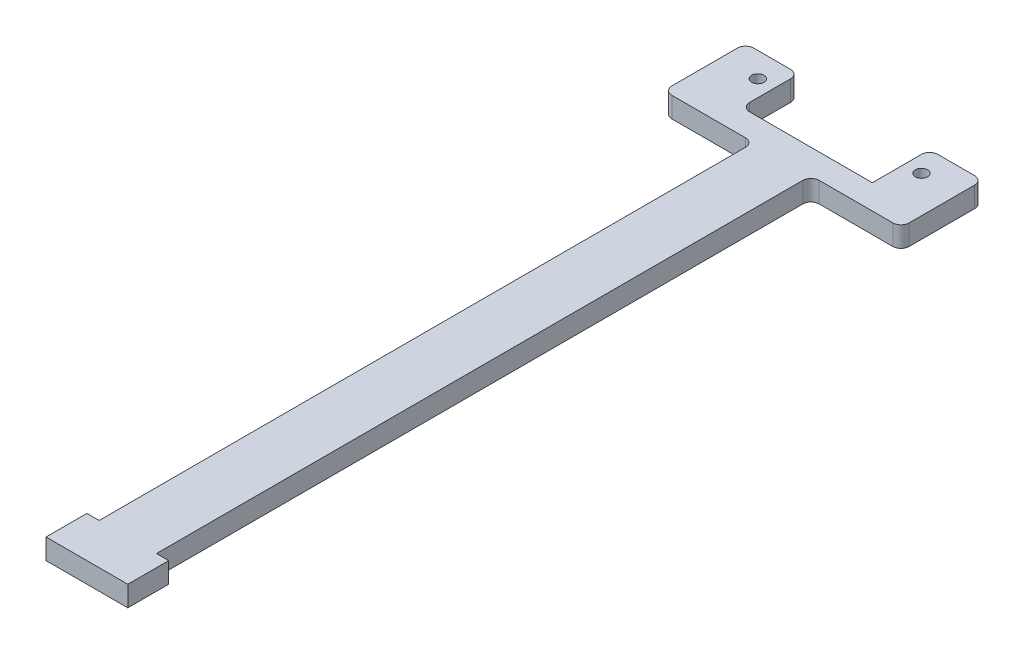
from build123d import *

# Parameters (mm, degrees)
BOSS_EXTRUDE1_DEPTH = 5
SKETCH2_R           = 1.5
SKETCH2_W           = 32
SKETCH2_H           = 14
CUT_EXTRUDE1_DEPTH  = 10
FILLET1_R           = 2


with BuildPart() as part:
    # Sketch1 → Boss-Extrude1 (new body)
    with BuildSketch(Plane(origin=(0, 0, 0), x_dir=(1, 0, 0), z_dir=(0, 1, 0))):
        Polygon((9, -10), (9, 0), (6, 0), (6, 160), (28, 160), (28, 180), (-30, 180), (-30, 160), (-8, 160), (-8, 0), (-11, 0), (-11, -10), align=None)
    extrude(amount=BOSS_EXTRUDE1_DEPTH)

    # Sketch2 → Cut-Extrude1 (cut)
    with BuildSketch(Plane(origin=(0, 5, 0), x_dir=(1, 0, 0), z_dir=(0, 1, 0))):
        with Locations(Location((-21, 174, 0), (0, 0, 270))):
            Circle(SKETCH2_R)
        with Locations(Location((19, 174, 0), (0, 0, 270))):
            Circle(SKETCH2_R)
        with Locations((-1, 173)):
            Rectangle(SKETCH2_W, SKETCH2_H)
    extrude(amount=-CUT_EXTRUDE1_DEPTH, mode=Mode.SUBTRACT)

    # Fillet1
    fillet1_edges = [part.edges().sort_by_distance(p)[0] for p in [
        (-8, 2.5, -160),
        (-30, 2.5, -160),
        (-30, 2.5, -180),
        (28, 2.5, -180),
        (28, 2.5, -160),
        (6, 2.5, -160),
        (15, 2.5, -180),
        (-17, 2.5, -166),
        (-17, 2.5, -180),
    ]]
    fillet(fillet1_edges, radius=FILLET1_R)


solid = part.part
